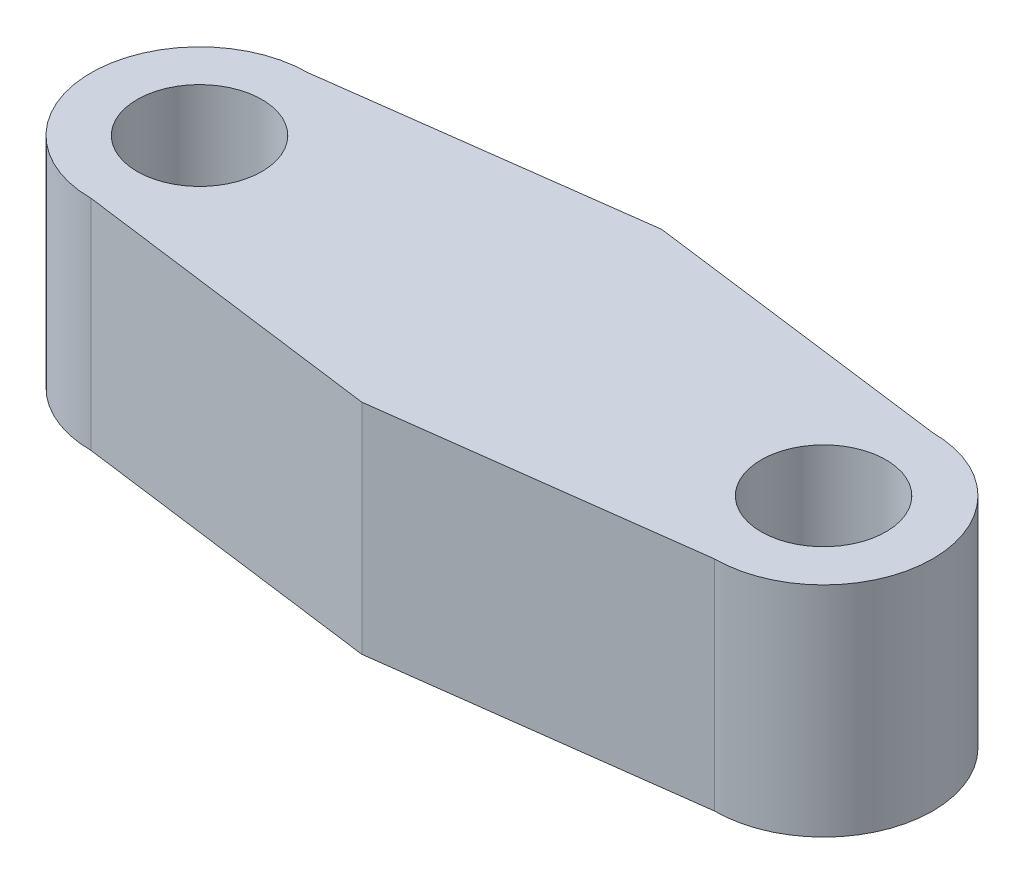
from build123d import *

# Parameters (mm, degrees)
SKETCH1_R           = 1
BOSS_EXTRUDE1_DEPTH = 3.5


with BuildPart() as part:
    # Sketch1 → Boss-Extrude1 (new body)
    with BuildSketch(Plane(origin=(0, 0, 0), x_dir=(1, 0, 0), z_dir=(0, 1, 0))):
        with BuildLine():
            Line((0, -2.4), (5, -1.749695866))
            ThreePointArc((5, -1.749695866), (6.749695866, 0), (5, 1.749695866))
            Line((5, 1.749695866), (0, 2.4))
            Line((0, 2.4), (-5, 1.74067676))
            ThreePointArc((-5, 1.74067676), (-6.74067676, 0), (-5, -1.74067676))
            Line((-5, -1.74067676), (0, -2.4))
        make_face()
        with Locations(Location((5, 0, 0), (0, 0, 270))):
            Circle(SKETCH1_R, mode=Mode.SUBTRACT)
        with Locations(Location((-5, 0, 0), (0, 0, 270))):
            Circle(SKETCH1_R, mode=Mode.SUBTRACT)
    extrude(amount=BOSS_EXTRUDE1_DEPTH)


solid = part.part
